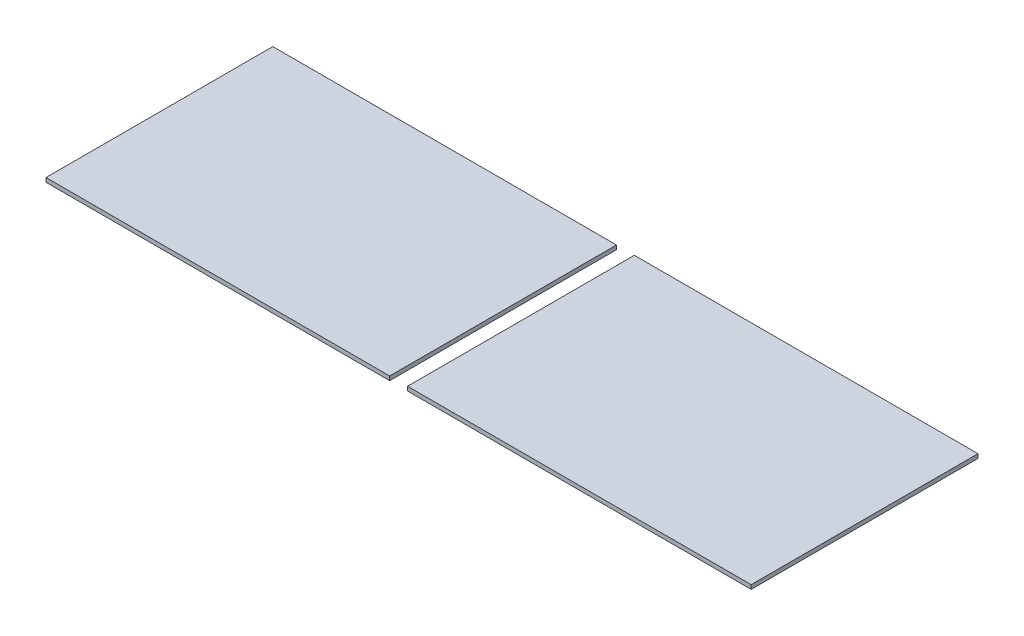
from build123d import *

# Parameters (mm, degrees)
SKETCH1_W           = 500
SKETCH1_H           = 330
BOSS_EXTRUDE1_DEPTH = 6


with BuildPart() as part:
    # Sketch1 → Boss-Extrude1 (new body)
    with BuildSketch(Plane(origin=(0, 0, 0), x_dir=(1, 0, 0), z_dir=(0, 1, 0))):
        with Locations((262.993902501, 0)):
            Rectangle(SKETCH1_W, SKETCH1_H)
    extrude(amount=BOSS_EXTRUDE1_DEPTH)


with BuildPart() as body_2:
    # Mirror1: mirrored copy
    add(part.part.mirror(Plane(origin=(0, 0, 0), x_dir=(0, 0, 1), z_dir=(1, 0, 0))))


solid = Compound([part.part, body_2.part])
